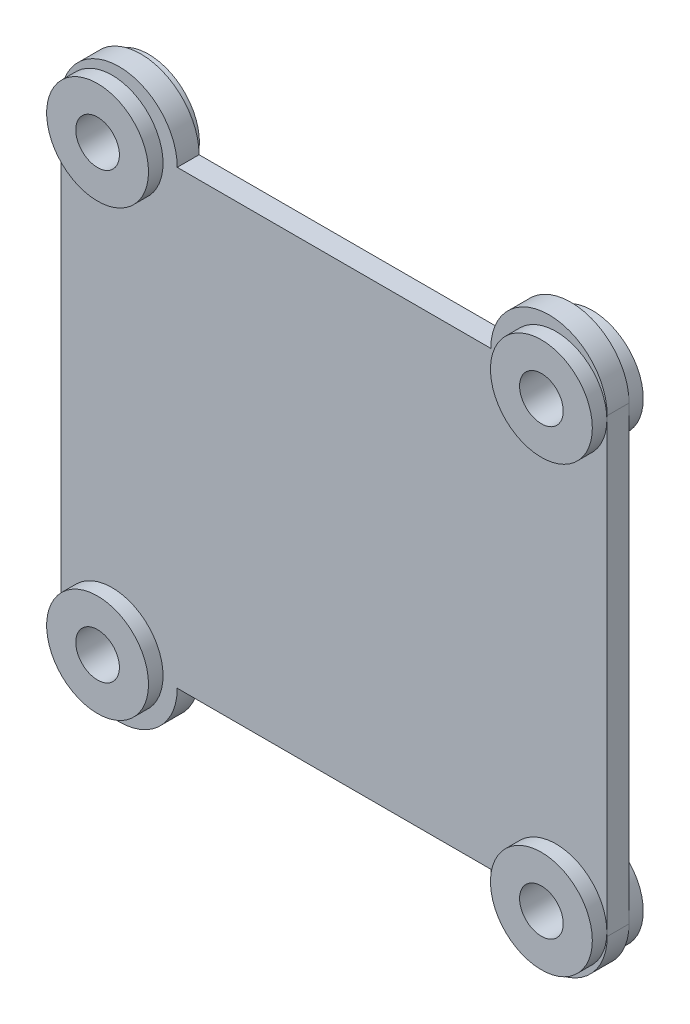
from build123d import *

# Parameters (mm, degrees)
CROQUIS1_R              = 2.5
SALIENTE_EXTRUIR1_DEPTH = 1.5
MATRIZL1_COUNT          = 2
MATRIZL1_PITCH          = 30.5
MATRIZL1_COUNT_DIR2     = 2
MATRIZL1_PITCH_DIR2     = 30.5


with BuildPart() as part:
    # Croquis1 → Saliente-Extruir1 (new body)
    with BuildSketch(Plane.XY):
        with BuildLine():
            Line((17.88322612, 13.695977011), (17.88322612, -17.304022989))
            ThreePointArc((17.88322612, -17.304022989), (13.88322612, -21.304022989), (9.88322612, -17.304022989))
            Line((9.88322612, -17.304022989), (-11.66677388, -17.304022989))
            ThreePointArc((-11.66677388, -17.304022989), (-15.66677388, -21.304022989), (-19.66677388, -17.304022989))
            Line((-19.66677388, -17.304022989), (-19.66677388, 13.695977011))
            ThreePointArc((-19.66677388, 13.695977011), (-15.66677388, 17.695977011), (-11.66677388, 13.695977011))
            Line((-11.66677388, 13.695977011), (9.88322612, 13.695977011))
            ThreePointArc((9.88322612, 13.695977011), (13.88322612, 17.695977011), (17.88322612, 13.695977011))
        make_face()
        with Locations((-16.14177388, 13.445977011)):
            Circle(CROQUIS1_R, mode=Mode.SUBTRACT)
        with Locations((14.35822612, 13.445977011)):
            Circle(CROQUIS1_R, mode=Mode.SUBTRACT)
        with Locations((14.35822612, -17.054022989)):
            Circle(CROQUIS1_R, mode=Mode.SUBTRACT)
        with Locations((-16.14177388, -17.054022989)):
            Circle(CROQUIS1_R, mode=Mode.SUBTRACT)
    extrude(amount=SALIENTE_EXTRUIR1_DEPTH)

    # Croquis3 → Revolución1 (revolve)
    with BuildSketch(Plane(origin=(0, -17.054022989, 0), x_dir=(-1, 0, 0), z_dir=(0, -1, 0)), mode=Mode.PRIVATE) as revoluci_n1_sk:
        Polygon((18.64177388, -1.5), (19.64177388, -1.5), (19.64177388, -2.5), (17.64177388, -2.5), (17.64177388, 1), (19.64177388, 1), (19.64177388, 0), (18.64177388, 0), align=None)
    revoluci_n1 = revolve(revoluci_n1_sk.sketch.rotate(Axis((-16.14177388, -17.054022989, 2.5), (0, 0, -1)), 180), axis=Axis((-16.14177388, -17.054022989, 2.5), (0, 0, -1)))

    # MatrizL1: Revoluci_n1 2 × 2
    with Locations(*[(i * MATRIZL1_PITCH, j * MATRIZL1_PITCH_DIR2, 0) for i in range(MATRIZL1_COUNT) for j in range(MATRIZL1_COUNT_DIR2) if (i, j) != (0, 0)]):
        add(revoluci_n1)


solid = part.part
